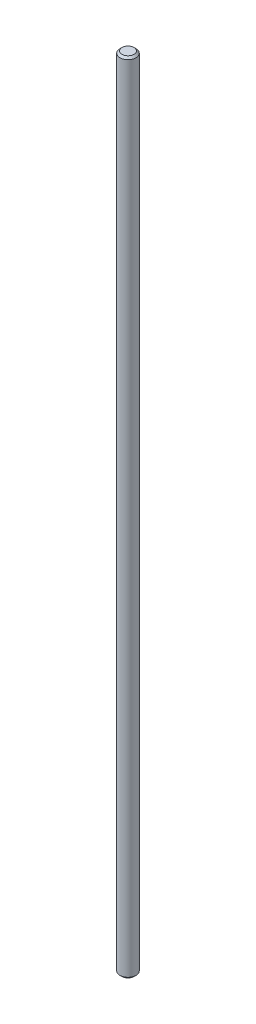
from build123d import *

# Parameters (mm, degrees)
SKETCH1_R           = 2
BOSS_EXTRUDE1_DEPTH = 100
CHAMFER1_SIZE       = 0.5


with BuildPart() as part:
    # Sketch1 → Boss-Extrude1 (new, symmetric)
    with BuildSketch(Plane(origin=(0, 0, 0), x_dir=(1, 0, 0), z_dir=(0, 1, 0))):
        with Locations(Location((0, 0, 0), (0, 0, 270))):
            Circle(SKETCH1_R)
    extrude(amount=BOSS_EXTRUDE1_DEPTH, both=True)

    # Chamfer1
    chamfer1_edges = [part.edges().sort_by_distance(p)[0] for p in [
        (0, -100, -2),
        (0, 100, -2),
    ]]
    chamfer(chamfer1_edges, length=CHAMFER1_SIZE)


solid = part.part
